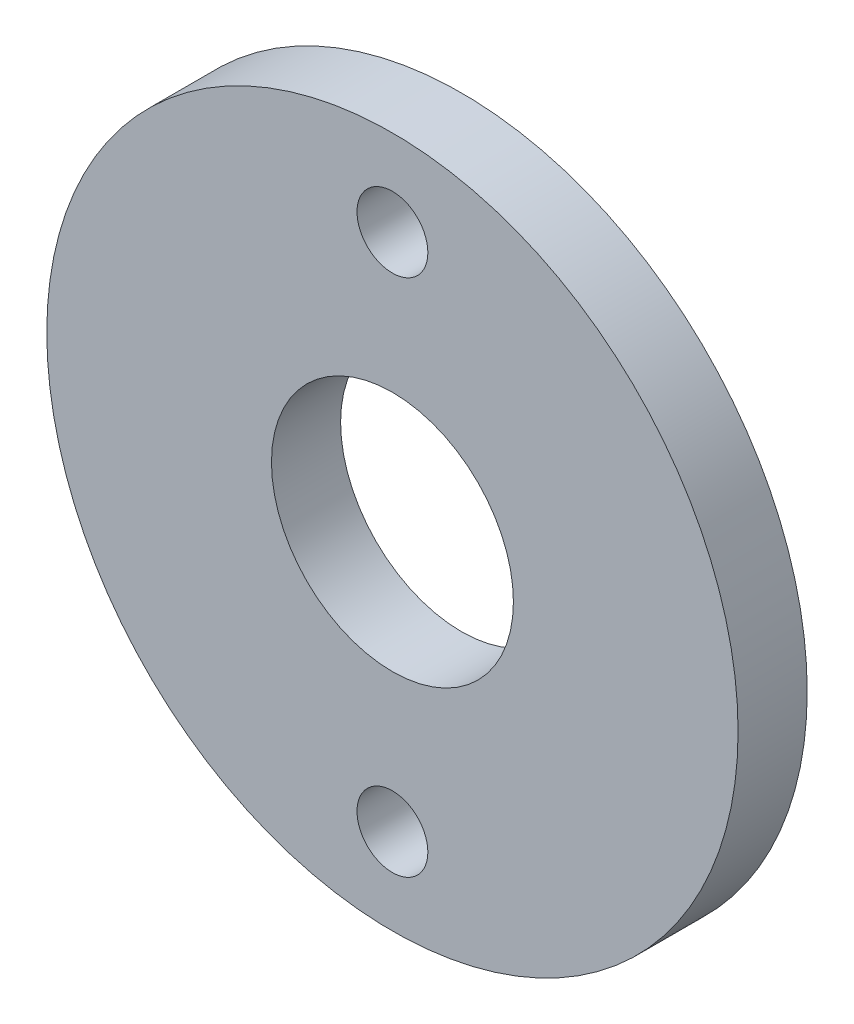
from build123d import *

# Parameters (mm, degrees)
CROQUIS1_R              = 10
SALIENTE_EXTRUIR1_DEPTH = 2
CROQUIS2_R              = 1.025
CROQUIS2_R_2            = 3.5
CORTAR_EXTRUIR1_DEPTH   = 3


with BuildPart() as part:
    # Croquis1 → Saliente-Extruir1 (new body)
    with BuildSketch(Plane.XY):
        Circle(CROQUIS1_R)
    extrude(amount=SALIENTE_EXTRUIR1_DEPTH)

    # Croquis2 → Cortar-Extruir1 (cut)
    with BuildSketch(Plane.XY.offset(2)):
        with Locations((0, 7.51)):
            Circle(CROQUIS2_R)
        with Locations((0, -7.51)):
            Circle(CROQUIS2_R)
        Circle(CROQUIS2_R_2)
    extrude(amount=-CORTAR_EXTRUIR1_DEPTH, mode=Mode.SUBTRACT)


solid = part.part
